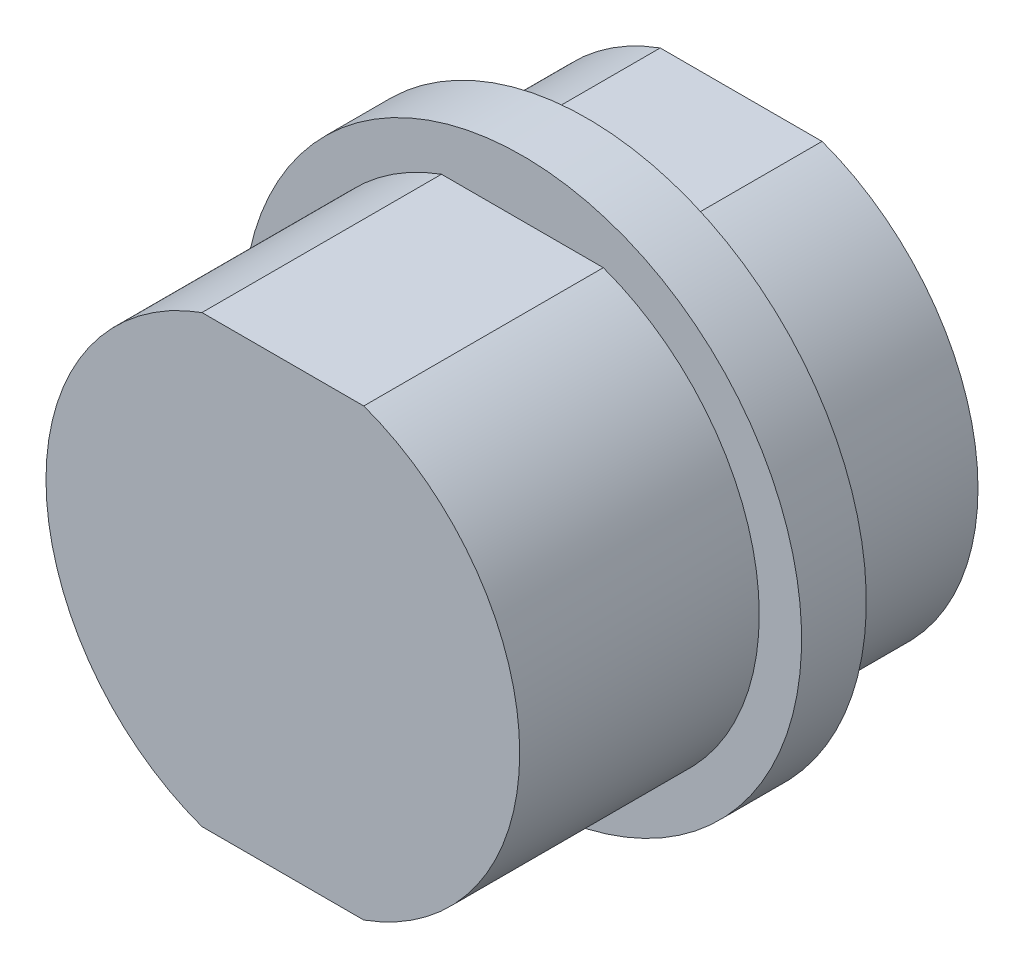
from build123d import *

# Parameters (mm, degrees)
SKETCH1_R           = 7.8105
BOSS_EXTRUDE1_DEPTH = 15.113
SKETCH2_W           = 14.883103562
SKETCH2_H           = 1.269889382
CUT_EXTRUDE1_DEPTH  = 19.719257183
BOSS_EXTRUDE2_START = -5.08
SKETCH3_R           = 9.2075
BOSS_EXTRUDE2_DEPTH = 2.1336


with BuildPart() as part:
    # Sketch1 → Boss-Extrude1 (new body)
    with BuildSketch(Plane.XY):
        Circle(SKETCH1_R)
    extrude(amount=BOSS_EXTRUDE1_DEPTH)

    # Sketch2 → Cut-Extrude1 (cut, through all)
    with BuildSketch(Plane.XY.offset(15.113)):
        with Locations((0, 7.975544691)):
            Rectangle(SKETCH2_W, SKETCH2_H)
        with Locations((0, -7.975544691)):
            Rectangle(SKETCH2_W, SKETCH2_H)
    extrude(amount=-CUT_EXTRUDE1_DEPTH, mode=Mode.SUBTRACT)

    # Sketch3 → Boss-Extrude2 (add)
    with BuildSketch(Plane(origin=(0, 0, 0), x_dir=(-1, 0, 0), z_dir=(0, 0, -1)).offset(BOSS_EXTRUDE2_START)):
        Circle(SKETCH3_R)
    extrude(amount=-BOSS_EXTRUDE2_DEPTH)


solid = part.part
